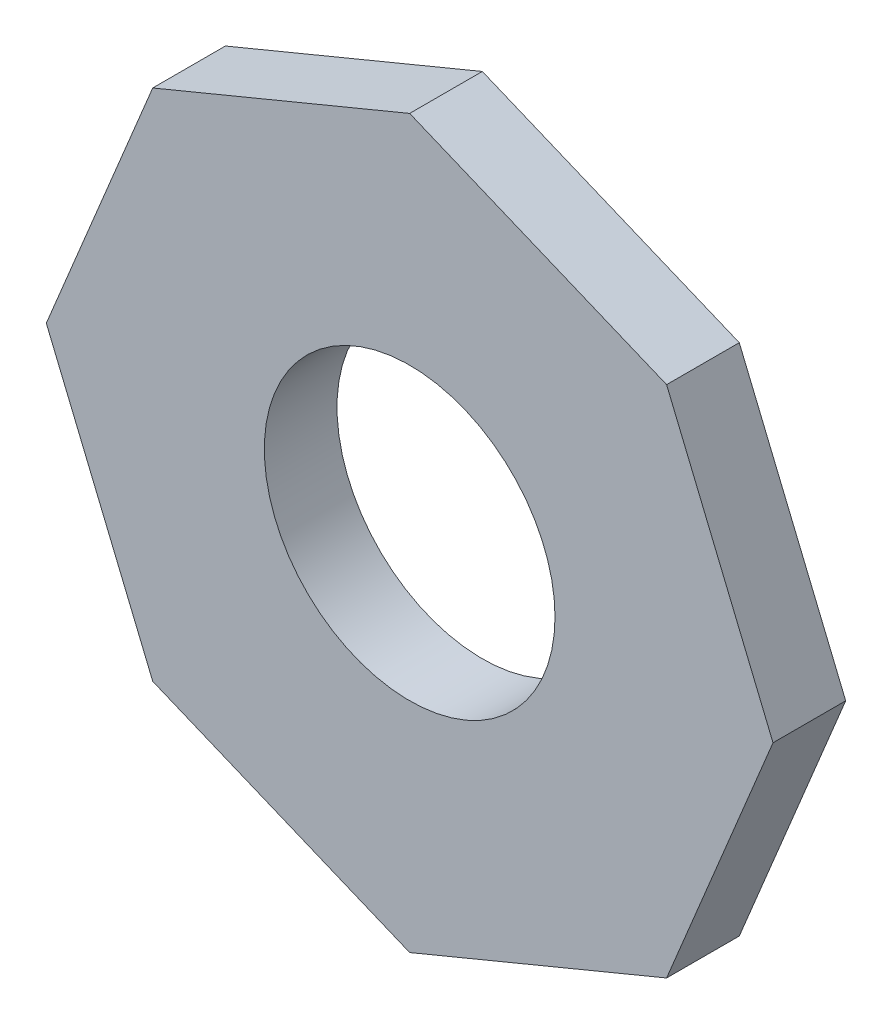
from build123d import *

# Parameters (mm, degrees)
EXTRUDE_1_DEPTH     = 100
SKETCH_2_R          = 200
CUT_EXTRUDE_2_DEPTH = 715.142842854


with BuildPart() as part:
    # 草图1 → 凸台-拉伸1 (new body)
    with BuildSketch(Plane.XY):
        Polygon((500, 0), (353.553390593, 353.553390593), (0, 500), (-353.553390593, 353.553390593), (-500, 0), (-353.553390593, -353.553390593), (0, -500), (353.553390593, -353.553390593), align=None)
    extrude(amount=EXTRUDE_1_DEPTH)

    # 草图2 → 切除-拉伸2 (cut, through all)
    with BuildSketch(Plane.XY):
        Circle(SKETCH_2_R)
    extrude(amount=CUT_EXTRUDE_2_DEPTH, mode=Mode.SUBTRACT)


solid = part.part
